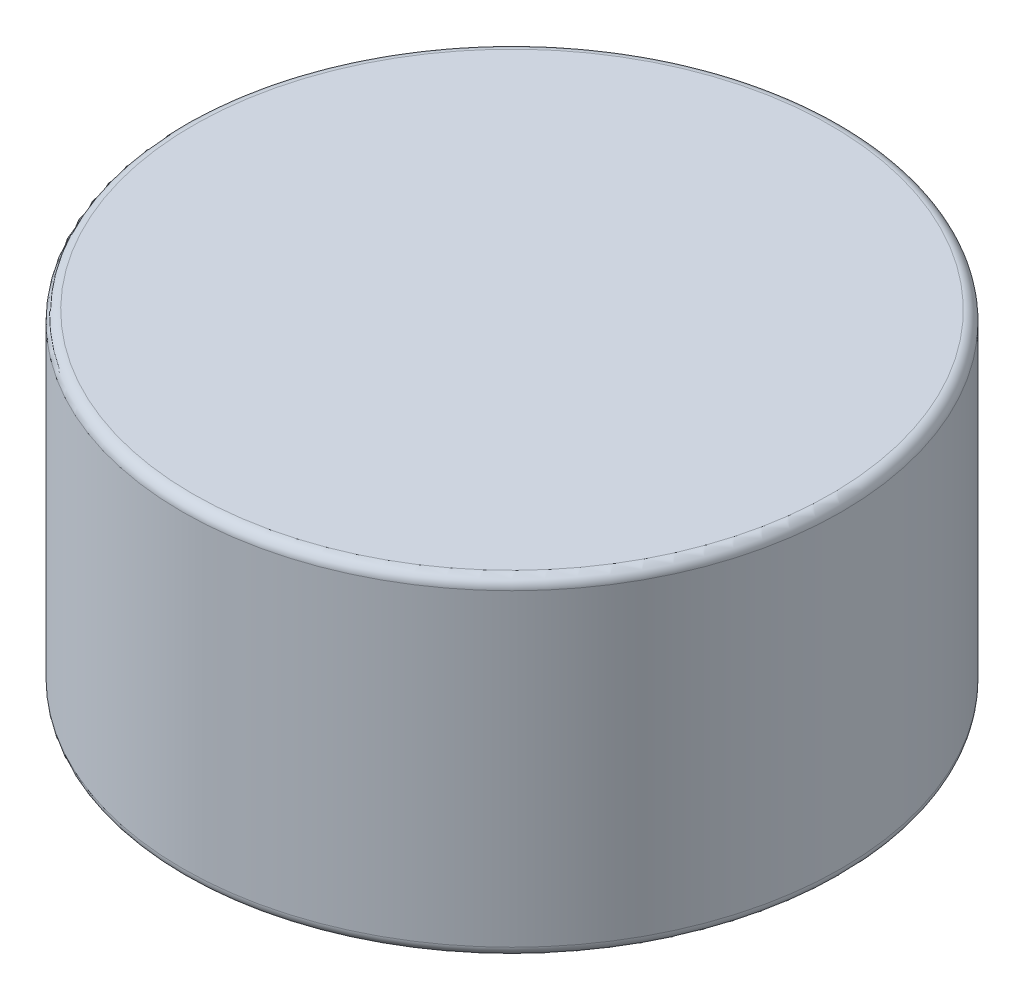
from build123d import *

# Parameters (mm, degrees)
SKETCH1_R           = 3.175
BOSS_EXTRUDE1_DEPTH = 3.175
FILLET1_R           = 0.1


with BuildPart() as part:
    # Sketch1 → Boss-Extrude1 (new body)
    with BuildSketch(Plane(origin=(0, 0, 0), x_dir=(1, 0, 0), z_dir=(0, 1, 0))):
        with Locations(Location((0, 0, 0), (0, 0, 270))):
            Circle(SKETCH1_R)
    extrude(amount=BOSS_EXTRUDE1_DEPTH)

    # Fillet1
    fillet1_edges = [part.edges().sort_by_distance(p)[0] for p in [
        (0, 0, -3.175),
        (0, 3.175, -3.175),
    ]]
    fillet(fillet1_edges, radius=FILLET1_R)


solid = part.part
